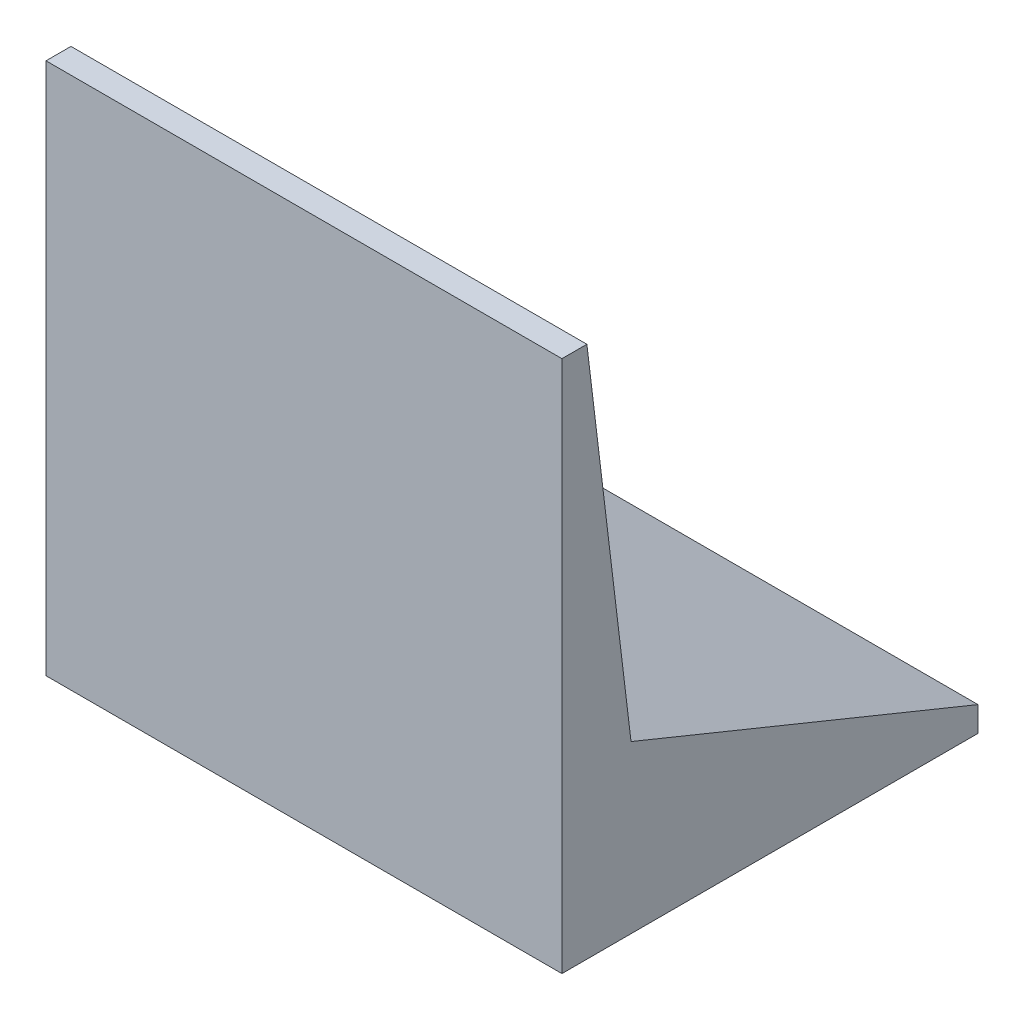
from build123d import *

# Parameters (mm, degrees)
BOSS_EXTRUDE1_DEPTH = 310


with BuildPart() as part:
    # Sketch1 → Boss-Extrude1 (new body)
    with BuildSketch(Plane(origin=(0, 0, 0), x_dir=(0, 0, -1), z_dir=(1, 0, 0))):
        Polygon((0, 0), (-250, 0), (-250, 320), (-235, 320), (-208.478747204, 100), (0, 15), align=None)
    extrude(amount=BOSS_EXTRUDE1_DEPTH)


solid = part.part
